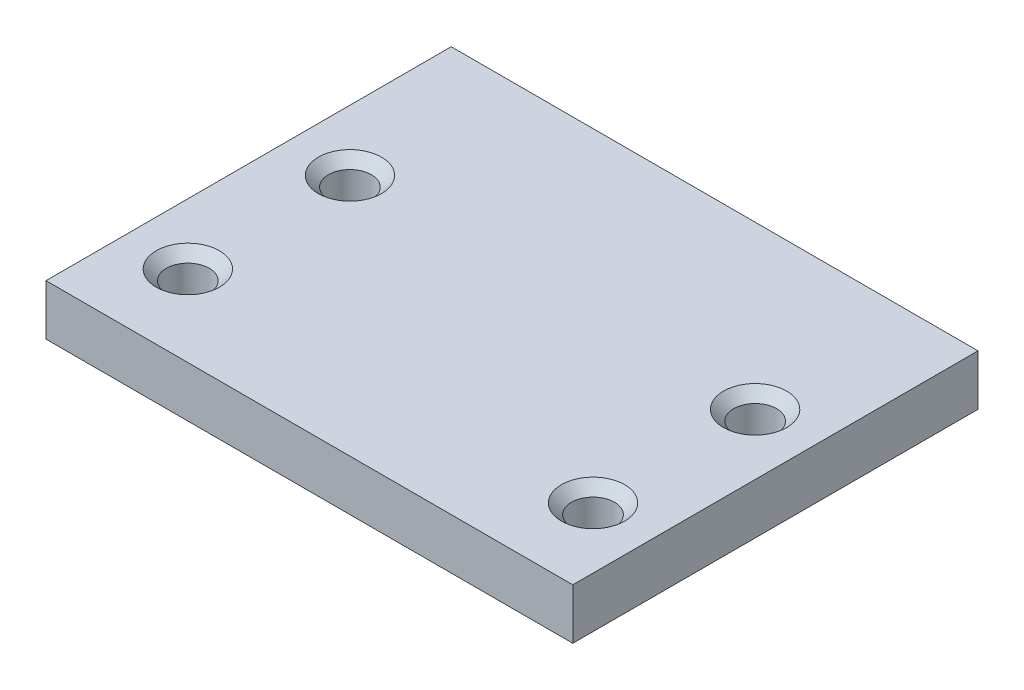
from build123d import *

# Parameters (mm, degrees)
SKETCH1_W            = 52
SKETCH1_H            = 40
SKETCH1_R            = 2.75
BOSS_EXTRUDE10_DEPTH = 5
SKETCH1_21_R         = 2.75
BOSS_EXTRUDE13_DEPTH = 5
SKETCH1_22_R         = 2.12
CUT_EXTRUDE4_DEPTH   = 7
CHAMFER1_SIZE        = 1
SKETCH1_23_R         = 2.75
BOSS_EXTRUDE14_DEPTH = 5
SKETCH1_24_R         = 2.12
CUT_EXTRUDE6_DEPTH   = 5
SKETCH1_25_R         = 2.75
BOSS_EXTRUDE15_DEPTH = 5
SKETCH1_26_R         = 2.12
CUT_EXTRUDE7_DEPTH   = 18
SKETCH1_29_R         = 2.75
BOSS_EXTRUDE17_DEPTH = 5
SKETCH1_30_R         = 2.12
CUT_EXTRUDE9_DEPTH   = 14
CHAMFER3_SIZE        = 1
CHAMFER4_SIZE        = 1
CHAMFER5_SIZE        = 1


with BuildPart() as part:
    # Sketch1 → Boss-Extrude10 (new body)
    with BuildSketch(Plane(origin=(0, 0, 0), x_dir=(1, 0, 0), z_dir=(0, 1, 0))):
        Rectangle(SKETCH1_W, SKETCH1_H)
        with Locations((-20, -12)):
            Circle(SKETCH1_R, mode=Mode.SUBTRACT)
        with Locations((20, -12)):
            Circle(SKETCH1_R, mode=Mode.SUBTRACT)
        with Locations((-20, 4)):
            Circle(SKETCH1_R, mode=Mode.SUBTRACT)
        with Locations((20, 4)):
            Circle(SKETCH1_R, mode=Mode.SUBTRACT)
    extrude(amount=BOSS_EXTRUDE10_DEPTH)

    # Sketch1<21> → Boss-Extrude13 (add)
    with BuildSketch(Plane(origin=(0, 0, 0), x_dir=(1, 0, 0), z_dir=(0, 1, 0))):
        with Locations((20, 4)):
            Circle(SKETCH1_21_R)
    extrude(amount=BOSS_EXTRUDE13_DEPTH)

    # Sketch1<22> → Cut-Extrude4 (cut)
    with BuildSketch(Plane(origin=(0, 0, 0), x_dir=(1, 0, 0), z_dir=(0, 1, 0))):
        with Locations((20, 4)):
            Circle(SKETCH1_22_R)
    extrude(amount=CUT_EXTRUDE4_DEPTH, mode=Mode.SUBTRACT)

    # Chamfer1
    chamfer1_edges = [part.edges().sort_by_distance(p)[0] for p in [
        (17.88, 5, -4),
    ]]
    chamfer(chamfer1_edges, length=CHAMFER1_SIZE)

    # Sketch1<23> → Boss-Extrude14 (add)
    with BuildSketch(Plane(origin=(0, 0, 0), x_dir=(1, 0, 0), z_dir=(0, 1, 0))):
        with Locations((20, -12)):
            Circle(SKETCH1_23_R)
    extrude(amount=BOSS_EXTRUDE14_DEPTH)

    # Sketch1<24> → Cut-Extrude6 (cut)
    with BuildSketch(Plane(origin=(0, 0, 0), x_dir=(1, 0, 0), z_dir=(0, 1, 0))):
        with Locations((20, -12)):
            Circle(SKETCH1_24_R)
    extrude(amount=CUT_EXTRUDE6_DEPTH, mode=Mode.SUBTRACT)

    # Sketch1<25> → Boss-Extrude15 (add)
    with BuildSketch(Plane(origin=(0, 0, 0), x_dir=(1, 0, 0), z_dir=(0, 1, 0))):
        with Locations((-20, -12)):
            Circle(SKETCH1_25_R)
    extrude(amount=BOSS_EXTRUDE15_DEPTH)

    # Sketch1<26> → Cut-Extrude7 (cut)
    with BuildSketch(Plane(origin=(0, 0, 0), x_dir=(1, 0, 0), z_dir=(0, 1, 0))):
        with Locations((-20, -12)):
            Circle(SKETCH1_26_R)
    extrude(amount=CUT_EXTRUDE7_DEPTH, mode=Mode.SUBTRACT)

    # Sketch1<29> → Boss-Extrude17 (add)
    with BuildSketch(Plane(origin=(0, 0, 0), x_dir=(1, 0, 0), z_dir=(0, 1, 0))):
        with Locations((-20, 4)):
            Circle(SKETCH1_29_R)
    extrude(amount=BOSS_EXTRUDE17_DEPTH)

    # Sketch1<30> → Cut-Extrude9 (cut)
    with BuildSketch(Plane(origin=(0, 0, 0), x_dir=(1, 0, 0), z_dir=(0, 1, 0))):
        with Locations((-20, 4)):
            Circle(SKETCH1_30_R)
    extrude(amount=CUT_EXTRUDE9_DEPTH, mode=Mode.SUBTRACT)

    # Chamfer3
    chamfer3_edges = [part.edges().sort_by_distance(p)[0] for p in [
        (-22.12, 5, -4),
    ]]
    chamfer(chamfer3_edges, length=CHAMFER3_SIZE)

    # Chamfer4
    chamfer4_edges = [part.edges().sort_by_distance(p)[0] for p in [
        (-22.12, 5, 12),
    ]]
    chamfer(chamfer4_edges, length=CHAMFER4_SIZE)

    # Chamfer5
    chamfer5_edges = [part.edges().sort_by_distance(p)[0] for p in [
        (17.88, 5, 12),
    ]]
    chamfer(chamfer5_edges, length=CHAMFER5_SIZE)


solid = part.part
